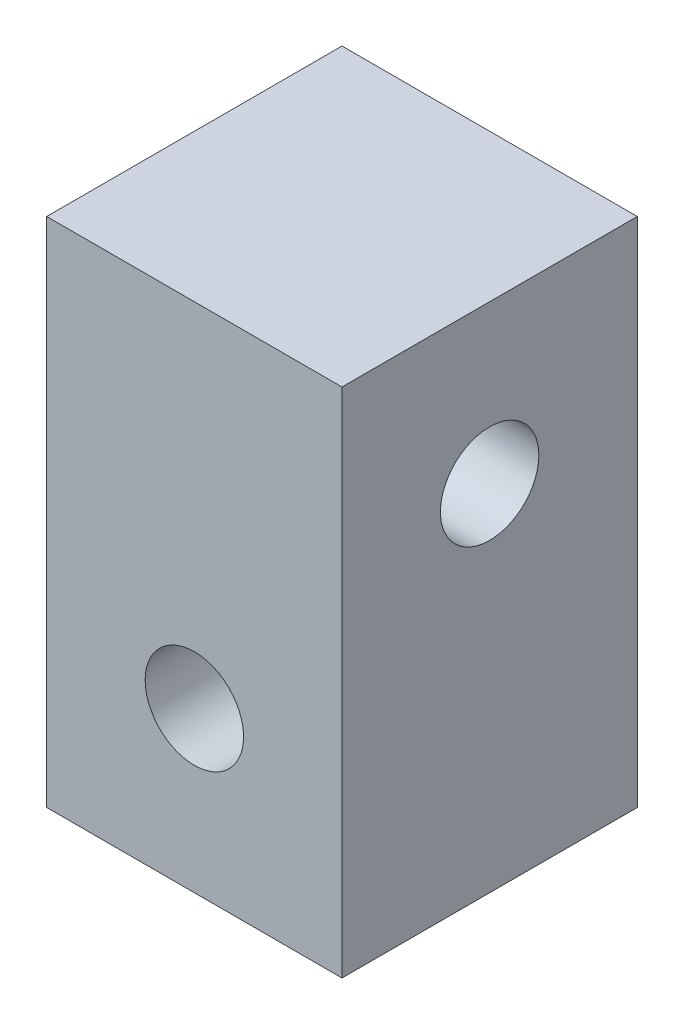
from build123d import *

# Parameters (mm, degrees)
SKETCH1_W           = 7.5
SKETCH1_H           = 7.5
BOSS_EXTRUDE1_DEPTH = 13
SKETCH2_R           = 1.25
CUT_EXTRUDE1_DEPTH  = 10
SKETCH3_R           = 1.25
CUT_EXTRUDE2_DEPTH  = 10


with BuildPart() as part:
    # Sketch1 → Boss-Extrude1 (new body)
    with BuildSketch(Plane(origin=(0, 0, 0), x_dir=(1, 0, 0), z_dir=(0, 1, 0))):
        Rectangle(SKETCH1_W, SKETCH1_H)
    extrude(amount=BOSS_EXTRUDE1_DEPTH)

    # Sketch2 → Cut-Extrude1 (cut)
    with BuildSketch(Plane(origin=(0, 0, -3.75), x_dir=(-1, 0, 0), z_dir=(0, 0, -1))):
        with Locations((0, 4.053058834)):
            Circle(SKETCH2_R)
    extrude(amount=-CUT_EXTRUDE1_DEPTH, mode=Mode.SUBTRACT)

    # Sketch3 → Cut-Extrude2 (cut)
    with BuildSketch(Plane(origin=(3.75, 0, 0), x_dir=(0, 0, -1), z_dir=(1, 0, 0))):
        with Locations((0, 9)):
            Circle(SKETCH3_R)
    extrude(amount=-CUT_EXTRUDE2_DEPTH, mode=Mode.SUBTRACT)


solid = part.part
